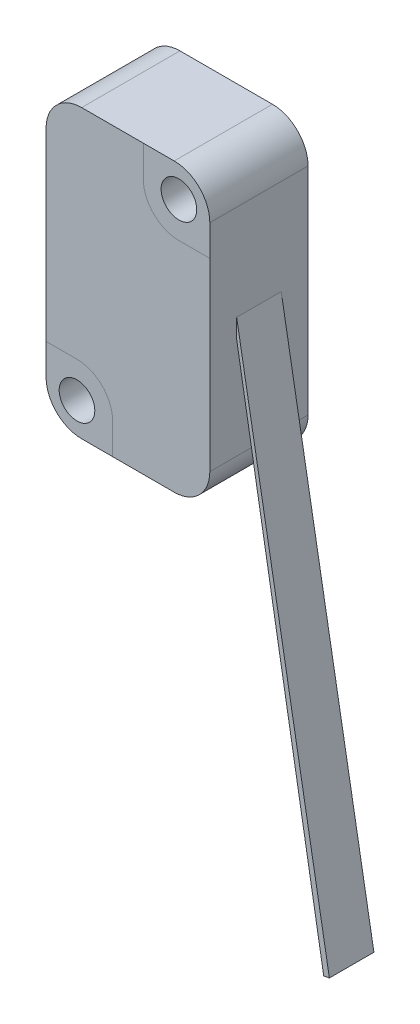
from build123d import *

# Parameters (mm, degrees)
SKETCH1_W                   = 15.875
SKETCH1_H                   = 27.813
BOSS_EXTRUDE1_DEPTH         = 4.7625
BOSS_EXTRUDE2_DEPTH         = 2.159
F_29_0_136_DIAMETER_HOLE1_D = 3.4544
FILLET1_R                   = 3.4544


with BuildPart() as part:
    # Sketch1 → Boss-Extrude1 (new, symmetric)
    with BuildSketch(Plane.XY):
        Rectangle(SKETCH1_W, SKETCH1_H)
    extrude(amount=BOSS_EXTRUDE1_DEPTH, both=True)

    # Sketch2 → Boss-Extrude2 (add, symmetric)
    with BuildSketch(Plane.XY):
        Polygon((7.9375, 1.2065), (16.926432647, -49.772270296), (16.376122074, -49.869304898), (7.9375, -0.655026961), align=None)
    extrude(amount=BOSS_EXTRUDE2_DEPTH, both=True)

    # #29 (0.136) Diameter Hole1 (through all)
    with Locations(Plane.XY.offset(4.7625)):
        with Locations((-4.9403, -10.9093), (4.9403, 10.9093)):
            Hole(F_29_0_136_DIAMETER_HOLE1_D / 2)

    # Fillet1
    fillet1_edges = [part.edges().sort_by_distance(p)[0] for p in [
        (-7.9375, -13.9065, 0),
        (7.9375, -13.9065, 0),
        (7.9375, 13.9065, 0),
        (-7.9375, 13.9065, 0),
    ]]
    fillet(fillet1_edges, radius=FILLET1_R)


solid = part.part
